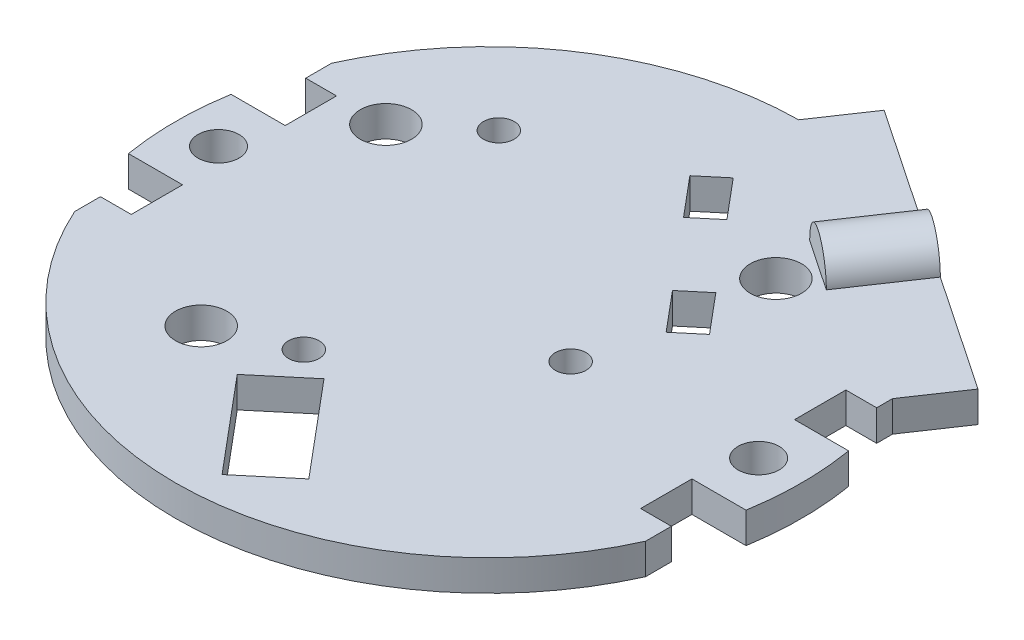
from build123d import *

# Parameters (mm, degrees)
CROQUIS1_R              = 30.5
SALIENTE_EXTRUIR1_DEPTH = 3
CORTAR_EXTRUIR3_START   = -4
CORTAR_EXTRUIR3_DEPTH   = 4
CORTAR_EXTRUIR5_DEPTH   = 4
CROQUIS8_R              = 1.5
CORTAR_EXTRUIR6_DEPTH   = 10
CORTAR_EXTRUIR8_START   = -3
CROQUIS10_R             = 2
CORTAR_EXTRUIR8_DEPTH   = 3
CROQUIS11_R             = 2.5
CORTAR_EXTRUIR9_DEPTH   = 3
CROQUIS13_W             = 33.894616986
CROQUIS13_H             = 3
SALIENTE_EXTRUIR2_DEPTH = 6
CROQUIS14_R             = 3
SALIENTE_EXTRUIR3_DEPTH = 8
CROQUIS17_R             = 1.5
CORTAR_EXTRUIR10_DEPTH  = 7


with BuildPart() as part:
    # Croquis1 → Saliente-Extruir1 (new body)
    with BuildSketch(Plane(origin=(0, 0, 0), x_dir=(1, 0, 0), z_dir=(0, 1, 0))):
        with Locations(Location((0, 0, 0), (0, 0, 270))):
            Circle(CROQUIS1_R)
    extrude(amount=SALIENTE_EXTRUIR1_DEPTH)

    # Croquis5 → Cortar-Extruir3 (cut)
    with BuildSketch(Plane(origin=(0, 3, 0), x_dir=(1, 0, 0), z_dir=(0, 1, 0)).offset(CORTAR_EXTRUIR3_START)):
        with BuildLine():
            Line((28.814059068, 5), (30.087372767, 5))
            ThreePointArc((30.087372767, 5), (29.556634924, 7.526973624), (28.814059068, 10))
            Line((28.814059068, 10), (24.814059068, 10))
            Line((24.814059068, 10), (24.814059068, 5))
            Line((24.814059068, 5), (28.814059068, 5))
        make_face()
        with BuildLine():
            Line((30.087372767, -5), (28.814059068, -5))
            Line((28.814059068, -5), (24.814059068, -5))
            Line((24.814059068, -5), (24.814059068, -10))
            Line((24.814059068, -10), (28.814059068, -10))
            ThreePointArc((28.814059068, -10), (29.556634924, -7.526973624), (30.087372767, -5))
        make_face()
        with BuildLine():
            Line((-24.814059068, 5), (-24.814059068, 10))
            Line((-24.814059068, 10), (-28.814059068, 10))
            ThreePointArc((-28.814059068, 10), (-29.556634924, 7.526973624), (-30.087372767, 5))
            Line((-30.087372767, 5), (-28.814059068, 5))
            Line((-28.814059068, 5), (-24.814059068, 5))
        make_face()
        with BuildLine():
            Line((-28.814059068, -10), (-24.814059068, -10))
            Line((-24.814059068, -10), (-24.814059068, -5))
            Line((-24.814059068, -5), (-28.814059068, -5))
            Line((-28.814059068, -5), (-30.087372767, -5))
            ThreePointArc((-30.087372767, -5), (-29.556634924, -7.526973624), (-28.814059068, -10))
        make_face()
    extrude(amount=CORTAR_EXTRUIR3_DEPTH, mode=Mode.SUBTRACT)

    # Croquis7 → Cortar-Extruir5 (cut)
    with BuildSketch(Plane(origin=(0, 3, 0), x_dir=(1, 0, 0), z_dir=(0, 1, 0))):
        Polygon((1.428390211, 22.411430151), (-0.869743118, 20.483067322), (2.34419493, 16.652845106), (4.642328259, 18.581207935), align=None)
        Polygon((10.266719844, 11.878319058), (7.968586515, 9.949956229), (9.575555539, 8.034845121), (11.182524563, 6.119734013), (13.480657893, 8.048096842), align=None)
    extrude(amount=-CORTAR_EXTRUIR5_DEPTH, mode=Mode.SUBTRACT)

    # Croquis8 → Cortar-Extruir6 (cut)
    with BuildSketch(Plane(origin=(0, 3, 0), x_dir=(1, 0, 0), z_dir=(0, 1, 0))):
        Polygon((-6.154858987, -18.33209617), (1.558592329, -27.524629488), (6.154858987, -23.66790383), (-1.558592329, -14.475370512), align=None)
        with BuildLine():
            ThreePointArc((-9.5, -16), (-10.232233047, -14.232233047), (-12, -13.5))
            ThreePointArc((-12, -13.5), (-13.767766953, -17.767766953), (-9.5, -16))
        make_face()
        with BuildLine():
            ThreePointArc((14.5, 16), (10.232233047, 17.767766953), (12, 13.5))
            ThreePointArc((12, 13.5), (13.767766953, 14.232233047), (14.5, 16))
        make_face()
        with Locations(Location((-14, 15, 0), (0, 0, 270))):
            Circle(CROQUIS8_R)
        with BuildLine():
            Line((10.118033989, 0), (7.881966011, 0))
            ThreePointArc((7.881966011, 0), (8.464766865, -2.401258538), (10.5, -1))
            ThreePointArc((10.5, -1), (10.401258538, -0.464766865), (10.118033989, 0))
        make_face()
        with BuildLine():
            ThreePointArc((10.118033989, 0), (9, 0.5), (7.881966011, 0))
            Line((7.881966011, 0), (10.118033989, 0))
        make_face()
        with Locations(Location((-5, -13, 0), (0, 0, 270))):
            Circle(CROQUIS8_R)
    extrude(amount=-CORTAR_EXTRUIR6_DEPTH, mode=Mode.SUBTRACT)

    # Croquis10 → Cortar-Extruir8 (cut)
    with BuildSketch(Plane(origin=(0, 3, 0), x_dir=(1, 0, 0), z_dir=(0, 1, 0)).offset(CORTAR_EXTRUIR8_START)):
        with BuildLine():
            Line((-27.814059068, -12.515115586), (-27.814059068, -10))
            Line((-27.814059068, -10), (-28.814059068, -10))
            ThreePointArc((-28.814059068, -10), (-28.341972277, -11.268655974), (-27.814059068, -12.515115586))
        make_face()
        with BuildLine():
            Line((-28.814059068, 10), (-27.814059068, 10))
            Line((-27.814059068, 10), (-27.814059068, 12.515115586))
            ThreePointArc((-27.814059068, 12.515115586), (-28.341972277, 11.268655974), (-28.814059068, 10))
        make_face()
        with BuildLine():
            Line((27.814059069, -10), (27.814059069, -12.515115586))
            ThreePointArc((27.814059069, -12.515115586), (28.341972277, -11.268655974), (28.814059068, -10))
            Line((28.814059068, -10), (27.814059069, -10))
        make_face()
        with BuildLine():
            ThreePointArc((28.814059069, 10), (28.341972277, 11.268655974), (27.814059069, 12.515115586))
            Line((27.814059069, 12.515115586), (27.814059069, 10))
            Line((27.814059069, 10), (28.814059069, 10))
        make_face()
        with Locations(Location((-26.314059068, 0, 0), (0, 0, 270))):
            Circle(CROQUIS10_R)
        with Locations(Location((26.314059069, 0, 0), (0, 0, 270))):
            Circle(CROQUIS10_R)
    extrude(amount=CORTAR_EXTRUIR8_DEPTH, mode=Mode.SUBTRACT)

    # Croquis11 → Cortar-Extruir9 (cut)
    with BuildSketch(Plane(origin=(0, 3, 0), x_dir=(1, 0, 0), z_dir=(0, 1, 0))):
        with BuildLine():
            Line((-1.702166058, 31.453976389), (29.801261699, 10.204646058))
            ThreePointArc((29.801261699, 10.204646058), (17.614576459, 26.114683535), (-1.702166058, 31.453976389))
        make_face()
        with Locations(Location((-20, 10, 0), (0, 0, 270))):
            Circle(CROQUIS11_R)
    extrude(amount=-CORTAR_EXTRUIR9_DEPTH, mode=Mode.SUBTRACT)

    # Croquis13 → Saliente-Extruir2 (add)
    with BuildSketch(Plane(origin=(14.04954782, 0, -20.829311224), x_dir=(-0.8290375725550413, 0, -0.5591929034707476), z_dir=(0.5591929034707475, 0, -0.8290375725550412))):
        with Locations((0.344307973, 1.5)):
            Rectangle(CROQUIS13_W, CROQUIS13_H)
    extrude(amount=SALIENTE_EXTRUIR2_DEPTH)

    # Croquis14 → Saliente-Extruir3 (add)
    with BuildSketch(Plane(origin=(17.404705241, 0, -25.803536659), x_dir=(-0.8290375725550413, 0, -0.5591929034707476), z_dir=(0.5591929034707476, 0, -0.8290375725550413))):
        with Locations((0.004307973, 3)):
            Circle(CROQUIS14_R)
    extrude(amount=-SALIENTE_EXTRUIR3_DEPTH)

    # Croquis17 → Cortar-Extruir10 (cut)
    with BuildSketch(Plane(origin=(17.404705241, 0, -25.803536659), x_dir=(-0.8290375725550413, 0, -0.5591929034707476), z_dir=(0.5591929034707476, 0, -0.8290375725550413))):
        with Locations((0.004307973, 3)):
            Circle(CROQUIS17_R)
    extrude(amount=-CORTAR_EXTRUIR10_DEPTH, mode=Mode.SUBTRACT)


solid = part.part
